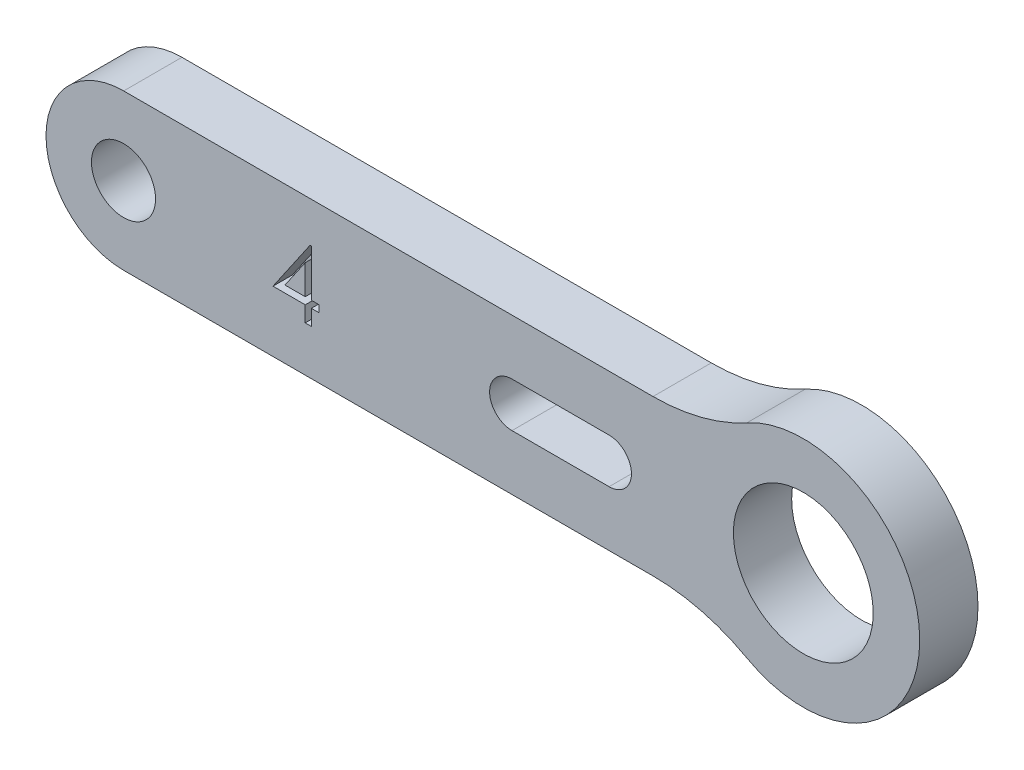
from build123d import *

# Parameters (mm, degrees)
SKETCH_1_R          = 1.65
SKETCH_1_R_2        = 3.6
EXTRUDE_1_DEPTH     = 3
CUT_EXTRUDE_1_DEPTH = 1


with BuildPart() as part:
    # 草图1 → 凸台-拉伸1 (new body)
    with BuildSketch(Plane.XY.offset(3)):
        with BuildLine():
            Line((15.64082314, 8), (-11.611020882, 8))
            ThreePointArc((-11.611020882, 8), (-15.611020882, 4), (-11.611020882, 0))
            Line((-11.611020882, 0), (15.646226321, 0))
            ThreePointArc((15.646226321, 0), (18.142339112, -0.316538794), (20.480428598, -1.246115814))
            ThreePointArc((20.480428598, -1.246115814), (29.372947843, 4.002649377), (20.478403544, 9.247982185))
            ThreePointArc((20.478403544, 9.247982185), (18.13880451, 8.317020651), (15.64082314, 8))
        make_face()
        with Locations(Location((-11.619385977, 4.000182729, 0), (0, 0, 180))):
            Circle(SKETCH_1_R, mode=Mode.SUBTRACT)
        with Locations(Location((23.379334845, 4.0005, 0), (0, 0, 180))):
            Circle(SKETCH_1_R_2, mode=Mode.SUBTRACT)
        with BuildLine():
            Line((13.380380647, 2.850266624), (8.378847398, 2.850266624))
            ThreePointArc((8.378847398, 2.850266624), (7.228847398, 4.000266624), (8.378847398, 5.150266624))
            Line((8.378847398, 5.150266624), (13.380380647, 5.150266624))
            ThreePointArc((13.380380647, 5.150266624), (14.530380647, 4.000266624), (13.380380647, 2.850266624))
        make_face(mode=Mode.SUBTRACT)
    extrude(amount=-EXTRUDE_1_DEPTH)

    # 草图2 → 切除-拉伸1 (cut)
    with BuildSketch(Plane.XY.offset(3)):
        Polygon((-2.014219225, 5.919649072), (-1.950417142, 5.919649072), (-1.950417142, 3.496572149), (-1.546570988, 3.496572149), (-1.546570988, 3.13759779), (-1.950417142, 3.13759779), (-1.950417142, 2.329905482), (-2.264519706, 2.329905482), (-2.264519706, 3.13759779), (-3.924776116, 3.13759779), align=None)
        Polygon((-2.264519706, 3.496572149), (-2.264519706, 5.0166042), (-3.307788937, 3.496572149), align=None, mode=Mode.SUBTRACT)
    extrude(amount=-CUT_EXTRUDE_1_DEPTH, mode=Mode.SUBTRACT)


solid = part.part
